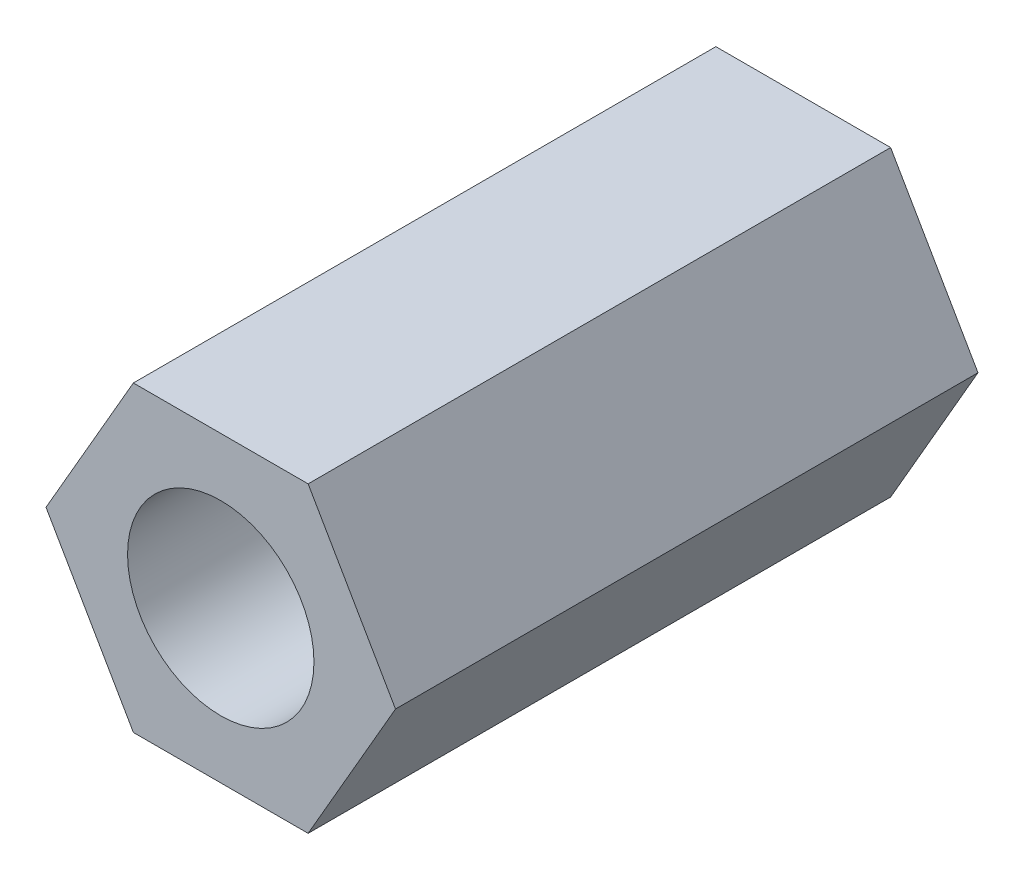
from build123d import *

# Parameters (mm, degrees)
SKETCH_1_R      = 1.6
EXTRUDE_1_DEPTH = 10


with BuildPart() as part:
    # 草图1 → 凸台-拉伸1 (new body)
    with BuildSketch(Plane.XY):
        Polygon((3, 0), (1.5, 2.598076211), (-1.5, 2.598076211), (-3, 0), (-1.5, -2.598076211), (1.5, -2.598076211), align=None)
        Circle(SKETCH_1_R, mode=Mode.SUBTRACT)
    extrude(amount=EXTRUDE_1_DEPTH)


solid = part.part
